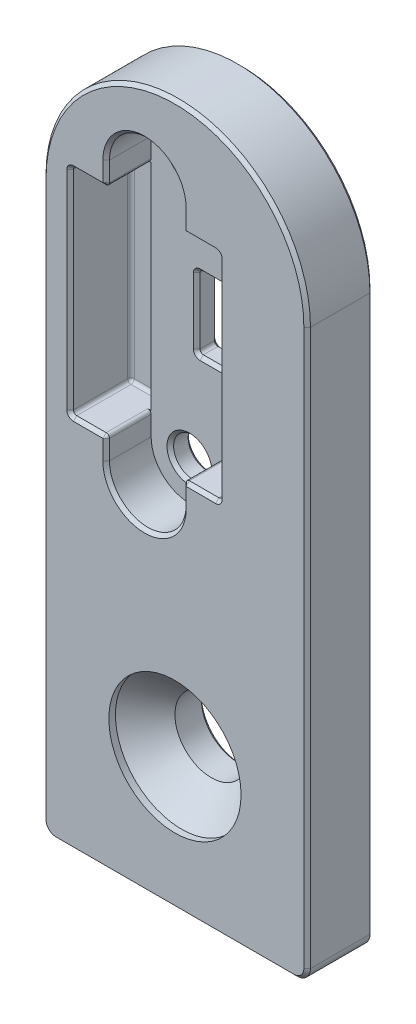
from build123d import *

# Parameters (mm, degrees)
SKETCH1_R           = 2.75
BOSS_EXTRUDE1_DEPTH = 5
CUT_EXTRUDE1_REACH  = 46.43
SKETCH5_R           = 1.45
SKETCH6_R           = 1.45
CUT_EXTRUDE2_DEPTH  = 3.4
SKETCH7_W           = 2.725
SKETCH7_H           = 16.25
CUT_EXTRUDE3_DEPTH  = 1.2
CUT_EXTRUDE4_REACH  = 46.278
SKETCH8_W           = 3.5
SKETCH8_H           = 5.5
FILLET1_R           = 1
FILLET3_R           = 0.25
CHAMFER2_SIZE       = 0.25


with BuildPart() as part:
    # Sketch1 → Boss-Extrude1 (new body)
    with BuildSketch(Plane.XY):
        with BuildLine():
            ThreePointArc((10, 33), (0, 43), (-10, 33))
            Line((-10, 33), (-10, -10))
            Line((-10, -10), (10, -10))
            Line((10, -10), (10, 33))
        make_face()
        Circle(SKETCH1_R, mode=Mode.SUBTRACT)
    extrude(amount=BOSS_EXTRUDE1_DEPTH)

    # Sketch4 → CSK for M5 Flat Head Machine Screw1 (revolve, cut)
    with BuildSketch(Plane(origin=(0, 0, 5), x_dir=(0, -1, 0), z_dir=(1, 0, 0))):
        Polygon((0, 0), (0, 5), (2.75, 5), (2.75, 2.75), (5, 0.5), (5, 0), align=None)
    revolve(axis=Axis((0, 0, 11.35), (0, 0, -1)), mode=Mode.SUBTRACT)

    # Sketch5 → Cut-Extrude1 (cut, up to next)
    with BuildSketch(Plane.XY.offset(5), mode=Mode.PRIVATE) as cut_extrude1_sk1:
        with Locations((-2.3, 36.35)):
            Circle(SKETCH5_R)
    cut_extrude1_tool1 = extrude(cut_extrude1_sk1.sketch, amount=-CUT_EXTRUDE1_REACH, mode=Mode.PRIVATE) & part.part
    # Sketch5 → Cut-Extrude1 (cut, up to next)
    with BuildSketch(Plane.XY.offset(5), mode=Mode.PRIVATE) as cut_extrude1_sk2:
        with Locations((-2.3, 16.65)):
            Circle(SKETCH5_R)
    cut_extrude1_tool2 = extrude(cut_extrude1_sk2.sketch, amount=-CUT_EXTRUDE1_REACH, mode=Mode.PRIVATE) & part.part
    add(cut_extrude1_tool1.solids().sort_by_distance((-2.3, 36.35, 5))[0], mode=Mode.SUBTRACT)
    add(cut_extrude1_tool2.solids().sort_by_distance((-2.3, 16.65, 5))[0], mode=Mode.SUBTRACT)

    # Sketch6 → Cut-Extrude2 (cut)
    with BuildSketch(Plane.XY.offset(5)):
        with BuildLine():
            Line((3.325, 34.625), (0.6, 34.625))
            Line((0.6, 34.625), (0.6, 36.35))
            ThreePointArc((0.6, 36.35), (-2.3, 39.25), (-5.2, 36.35))
            Line((-5.2, 36.35), (-5.2, 34.625))
            Line((-5.2, 34.625), (-7.925, 34.625))
            Line((-7.925, 34.625), (-7.925, 18.375))
            Line((-7.925, 18.375), (-5.2, 18.375))
            Line((-5.2, 18.375), (-5.2, 16.65))
            ThreePointArc((-5.2, 16.65), (-2.3, 13.75), (0.6, 16.65))
            Line((0.6, 16.65), (0.6, 18.375))
            Line((0.6, 18.375), (3.325, 18.375))
            Line((3.325, 18.375), (3.325, 34.625))
        make_face()
        with Locations((-2.3, 36.35)):
            Circle(SKETCH6_R, mode=Mode.SUBTRACT)
        with Locations((-2.3, 16.65)):
            Circle(SKETCH6_R, mode=Mode.SUBTRACT)
    extrude(amount=-CUT_EXTRUDE2_DEPTH, mode=Mode.SUBTRACT)

    # Sketch7 → Cut-Extrude3 (cut)
    with BuildSketch(Plane.XY.offset(1.6)):
        with Locations((-6.5625, 26.5)):
            Rectangle(SKETCH7_W, SKETCH7_H)
    extrude(amount=-CUT_EXTRUDE3_DEPTH, mode=Mode.SUBTRACT)

    # Sketch8 → Cut-Extrude4 (cut, up to next)
    with BuildSketch(Plane.XY.offset(1.6), mode=Mode.PRIVATE) as cut_extrude4_sk1:
        with Locations((0, 26.5)):
            Rectangle(SKETCH8_W, SKETCH8_H)
    cut_extrude4_tool1 = extrude(cut_extrude4_sk1.sketch, amount=-CUT_EXTRUDE4_REACH, mode=Mode.PRIVATE) & part.part
    add(cut_extrude4_tool1.solids().sort_by_distance((0, 26.5, 1.6))[0], mode=Mode.SUBTRACT)

    # Fillet1
    fillet1_edges = [part.edges().sort_by_distance(p)[0] for p in [
        (10, -10, 2.5),
        (-10, -10, 2.5),
    ]]
    fillet(fillet1_edges, radius=FILLET1_R)

    # Fillet3
    fillet3_edges = [part.edges().sort_by_distance(p)[0] for p in [
        (1.75, 29.25, 0.8),
        (1.75, 23.75, 0.8),
        (-1.75, 23.75, 0.8),
        (-1.75, 29.25, 0.8),
        (0.6, 34.625, 3.3),
        (3.325, 34.625, 3.3),
        (3.325, 18.375, 3.3),
        (0.6, 18.375, 3.3),
        (-5.2, 18.375, 3.3),
        (-7.925, 18.375, 2.7),
        (-7.925, 34.625, 2.7),
        (-5.2, 34.625, 3.3),
        (-7.925, 26.5, 0.4),
        (-6.5625, 34.625, 0.4),
        (-5.2, 26.5, 0.4),
        (-6.5625, 18.375, 0.4),
    ]]
    fillet(fillet3_edges, radius=FILLET3_R)

    # Chamfer2
    chamfer2_edges = [part.edges().sort_by_distance(p)[0] for p in [
        (0, 43, 5),
        (0, -10, 0),
        (-9.707106781, -9.707106781, 0),
        (9.707106781, -9.707106781, 0),
        (0, -10, 5),
        (-9.707106781, -9.707106781, 5),
        (9.707106781, -9.707106781, 5),
        (-6.5625, 34.625, 5),
        (-6.5625, 18.375, 5),
        (-7.925, 26.5, 5),
        (1.9625, 34.625, 5),
        (3.325, 26.5, 5),
        (1.9625, 18.375, 5),
        (1.75, 26.5, 1.6),
        (0, 23.75, 1.6),
        (-1.75, 26.5, 1.6),
        (0, 29.25, 1.6),
        (-1.75, 26.5, 0),
        (0, 29.25, 0),
        (-10, 12, 5),
        (1.75, 26.5, 0),
        (0, 23.75, 0),
        (-7.851776695, 34.551776695, 5),
        (-7.851776695, 18.448223305, 5),
        (3.251776695, 18.448223305, 5),
        (3.251776695, 34.551776695, 5),
        (-1.676776695, 29.176776695, 1.6),
        (-1.676776695, 29.176776695, 0),
        (1.676776695, 29.176776695, 1.6),
        (1.676776695, 29.176776695, 0),
        (1.676776695, 23.823223305, 1.6),
        (1.676776695, 23.823223305, 0),
        (-1.676776695, 23.823223305, 1.6),
        (-1.676776695, 23.823223305, 0),
        (-3.75, 36.35, 0),
        (-3.75, 16.65, 0),
        (-5.2, 17.3875, 5),
        (-3.75, 36.35, 1.6),
        (0.6, 35.6125, 5),
        (-3.75, 16.65, 1.6),
        (-2.3, 39.25, 5),
        (-5.2, 35.6125, 5),
        (-2.3, 13.75, 5),
        (0.6, 17.3875, 5),
        (10, 12, 5),
        (-2.75, 0, 0),
        (-10, 12, 0),
        (0, 43, 0),
        (10, 12, 0),
    ]]
    chamfer(chamfer2_edges, length=CHAMFER2_SIZE)


solid = part.part
